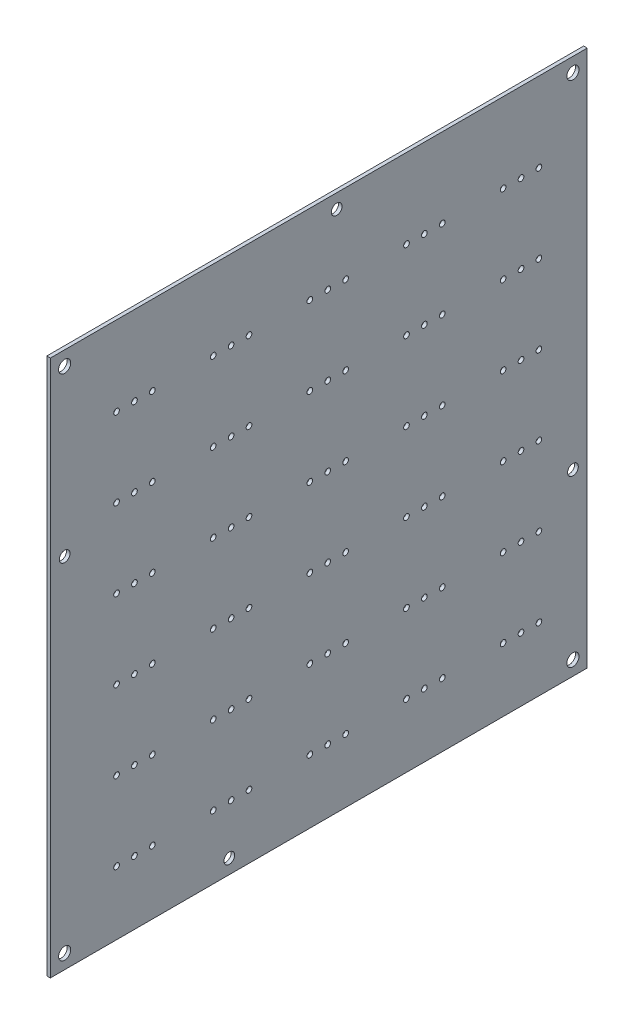
from build123d import *

# Parameters (mm, degrees)
SKETCH2_W            = 150
SKETCH2_H            = 150
BOSS_EXTRUDE1_DEPTH  = 1
SKETCH4_R            = 0.79375
CUT_EXTRUDE1_DEPTH   = 160.418359102
LPATTERN1_COUNT      = 5
LPATTERN1_PITCH      = 27
LPATTERN1_COUNT_DIR2 = 6
LPATTERN1_PITCH_DIR2 = 22
M3_CLEARANCE_HOLE1_D = 3.4
SKETCH8_R            = 1.5
CUT_EXTRUDE2_DEPTH   = 160.418359102


with BuildPart() as part:
    # Sketch2 → Boss-Extrude1 (new body)
    with BuildSketch(Plane(origin=(0, 0, 0), x_dir=(0, 0, -1), z_dir=(1, 0, 0))):
        with Locations((34.101040119, -41.233283804)):
            Rectangle(SKETCH2_W, SKETCH2_H)
    extrude(amount=BOSS_EXTRUDE1_DEPTH)

    # Sketch4 → Cut-Extrude1 (cut, through all)
    with BuildSketch(Plane(origin=(1, 0, 0), x_dir=(0, 0, -1), z_dir=(1, 0, 0))):
        with Locations((-22.398959881, 11.548854602)):
            Circle(SKETCH4_R)
        with Locations((-17.398959881, 11.548854602)):
            Circle(SKETCH4_R)
        with Locations((-12.398959881, 11.548854602)):
            Circle(SKETCH4_R)
    cut_extrude1 = extrude(amount=-CUT_EXTRUDE1_DEPTH, mode=Mode.SUBTRACT)

    # LPattern1: Cut-Extrude1 5 × 6
    with Locations(*[(0, -j * LPATTERN1_PITCH_DIR2, -i * LPATTERN1_PITCH) for i in range(LPATTERN1_COUNT) for j in range(LPATTERN1_COUNT_DIR2) if (i, j) != (0, 0)]):
        add(cut_extrude1, mode=Mode.SUBTRACT)

    # M3 Clearance Hole1 (through all)
    with Locations(Plane(origin=(1, 0, 0), x_dir=(0, 0, -1), z_dir=(1, 0, 0))):
        with Locations((-36.898959881, 29.766716196), (105.101040119, 29.766716196), (105.101040119, -112.233283804), (-36.898959881, -112.233283804)):
            Hole(M3_CLEARANCE_HOLE1_D / 2)

    # Sketch8 → Cut-Extrude2 (cut, through all)
    with BuildSketch(Plane(origin=(1, 0, 0), x_dir=(0, 0, -1), z_dir=(1, 0, 0))):
        with Locations((39.101040119, 29.766716196)):
            Circle(SKETCH8_R)
        with Locations((-36.898959881, -16.233283804)):
            Circle(SKETCH8_R)
        with Locations((9.101040119, -112.233283804)):
            Circle(SKETCH8_R)
        with Locations((105.101040119, -66.233283804)):
            Circle(SKETCH8_R)
    extrude(amount=-CUT_EXTRUDE2_DEPTH, mode=Mode.SUBTRACT)


solid = part.part
